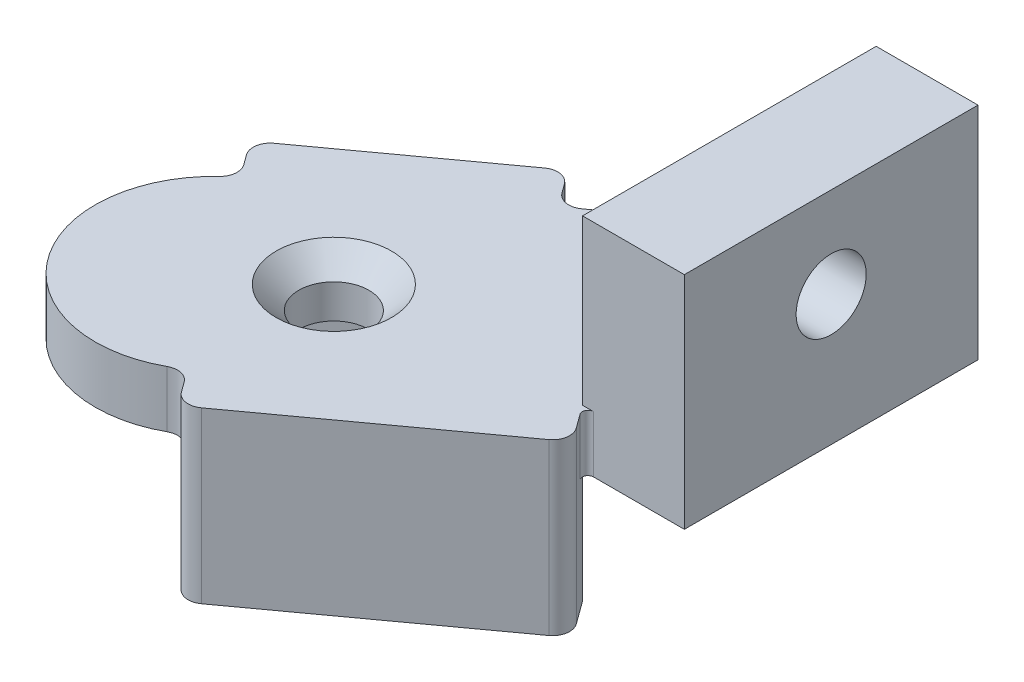
from build123d import *

# Parameters (mm, degrees)
SKETCH_1_R             = 1.55
EXTRUDE_397_DEPTH      = 2.5
EXTRUDE_START          = 2.5
EXTRUDE_640_DEPTH      = 7.5
SKETCH_3_W             = 4.5
SKETCH_3_H             = 12.978713764
EXTRUDE_1_DEPTH        = 9.75
CHAMFER_1_SIZE         = 1
CUT_EXTRUDE_1239_DEPTH = 2
CUT_EXTRUDE_M3_REACH   = 27.038
SKETCH_6_R             = 1.55
FILLET_5_R             = 0.75
FILLET_6_R             = 0.25


with BuildPart() as part:
    # 草图1 → Extrude 397 (new body)
    with BuildSketch(Plane(origin=(0, 0, 0), x_dir=(1, 0, 0), z_dir=(0, 1, 0))):
        with BuildLine():
            Line((10.1243866, 13.845154317), (-6.15423406, 2.01804411))
            ThreePointArc((-6.15423406, 2.01804411), (-7.315700706, -5.315167685), (0.017511089, -6.476634331))
            Line((0.017511089, -6.476634331), (10.1243866, 0.866440553))
            Line((10.1243866, 0.866440553), (10.1243866, 13.845154317))
        make_face()
        with Locations(Location((0, 0, 0), (0, 0, 270))):
            Circle(SKETCH_1_R, mode=Mode.SUBTRACT)
    extrude(amount=EXTRUDE_397_DEPTH)

    # 草图2 → Extrude 640 (add)
    with BuildSketch(Plane(origin=(0, 0, 0), x_dir=(1, 0, 0), z_dir=(0, 1, 0)).offset(EXTRUDE_START)):
        Polygon((0.017511089, -6.476634331), (1.193081594, -8.09466832), (11.299957105, -0.751593436), (10.1243866, 0.866440553), align=None)
        Polygon((-7.329804565, 3.636078099), (0.809505765, 9.549633202), (1.98507627, 7.931599213), (-6.15423406, 2.01804411), align=None)
    extrude(amount=-EXTRUDE_640_DEPTH)

    # 草图3 → 限位-1 (add)
    with BuildSketch(Plane(origin=(0, 0, 0), x_dir=(1, 0, 0), z_dir=(0, 1, 0))):
        with Locations((12.3743866, 7.355797435)):
            Rectangle(SKETCH_3_W, SKETCH_3_H)
    extrude(amount=EXTRUDE_1_DEPTH)

    # 倒角1
    chamfer_1_edges = [part.edges().sort_by_distance(p)[0] for p in [
        (0, 2.5, -1.55),
    ]]
    chamfer(chamfer_1_edges, length=CHAMFER_1_SIZE)

    # 草图5 → Cut-Extrude 1239 (cut)
    with BuildSketch(Plane.ZY.offset(-10.1243866)):
        Polygon((-4.151503441, 5.755), (-5.753650438, 8.53), (-8.957944432, 8.53), (-10.560091429, 5.755), (-8.957944432, 2.98), (-5.753650438, 2.98), align=None)
    extrude(amount=-CUT_EXTRUDE_1239_DEPTH, mode=Mode.SUBTRACT)

    # 草图6 → M3螺孔 (cut, up to next)
    with BuildSketch(Plane.ZY.offset(-10.1243866), mode=Mode.PRIVATE) as cut_extrude_m3_sk1:
        with Locations((-7.355797435, 5.755)):
            Circle(SKETCH_6_R)
    cut_extrude_m3_tool1 = extrude(cut_extrude_m3_sk1.sketch, amount=-CUT_EXTRUDE_M3_REACH, mode=Mode.PRIVATE) & part.part
    add(cut_extrude_m3_tool1.solids().sort_by_distance((10.124387, 5.755, -7.355797))[0], mode=Mode.SUBTRACT)

    # 圆角5
    fillet_5_edges = [part.edges().sort_by_distance(p)[0] for p in [
        (11.299957105, -1.25, 0.751593436),
        (1.193081594, -1.25, 8.09466832),
        (1.98507627, 1.25, -7.931599213),
        (-7.329804565, -1.25, -3.636078099),
        (0.809505765, -1.25, -9.549633202),
        (-6.15423406, 1.25, -2.01804411),
        (0.017511089, 1.25, 6.476634331),
    ]]
    fillet(fillet_5_edges, radius=FILLET_5_R)

    # 圆角6
    fillet_6_edges = [part.edges().sort_by_distance(p)[0] for p in [
        (10.1243866, 1.25, -0.866440553),
    ]]
    fillet(fillet_6_edges, radius=FILLET_6_R)


solid = part.part
